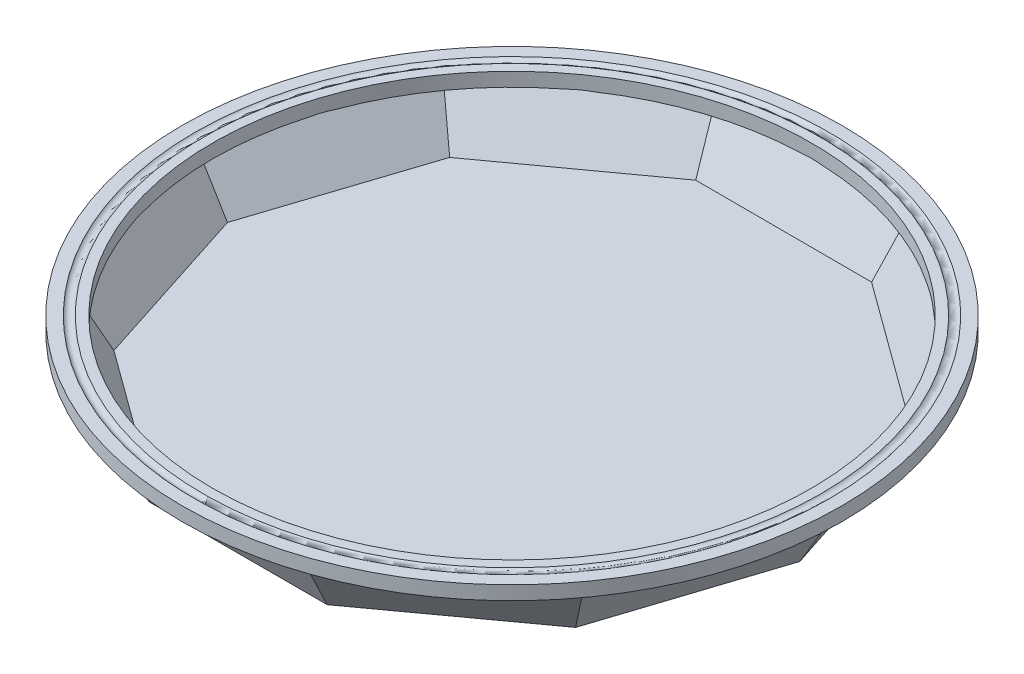
from build123d import *

# Parameters (mm, degrees)
STAGE1EX_DEPTH      = 30
STAGE1EX_DRAFT      = -30
STAGE1IN_DEPTH      = 27
STAGE1IN_DRAFT      = -30
SKETCH8_R           = 143.211859946
SKETCH8_R_2         = 130
BOSS_EXTRUDE2_DEPTH = 6
SKETCH15_R          = 2.38


with BuildPart() as part:
    # Sketch4 → Stage1Ex (with draft: the straight prism first)
    with BuildSketch(Plane(origin=(0, 0, 0), x_dir=(1, 0, 0), z_dir=(0, 1, 0))):
        Polygon((38.627124297, -118.882064537), (101.127124297, -73.473156537), (125, 0), (101.127124297, 73.473156537), (38.627124297, 118.882064537), (-38.627124297, 118.882064537), (-101.127124297, 73.473156537), (-125, 0), (-101.127124297, -73.473156537), (-38.627124297, -118.882064537), align=None)
    extrude(amount=STAGE1EX_DEPTH)
    # Stage1Ex: the draft: its side faces are tilted about the plane it starts from
    stage1ex_sides = [part.faces().sort_by_distance(p)[0] for p in [
        (69.877124297, 15, 96.177610537),
        (113.063562148, 15, 36.736578268),
        (113.063562148, 15, -36.736578268),
        (69.877124297, 15, -96.177610537),
        (0, 15, -118.882064537),
        (-69.877124297, 15, -96.177610537),
        (-113.063562148, 15, -36.736578268),
        (-113.063562148, 15, 36.736578268),
        (-69.877124297, 15, 96.177610537),
        (0, 15, 118.882064537),
    ]]
    draft(stage1ex_sides, Plane(origin=(0, 0, 0), x_dir=(1, 0, 0), z_dir=(0, 1, 0)), STAGE1EX_DRAFT)


with BuildPart() as stage1in_tool:
    # Sketch7 → Stage1In (with draft: the straight prism first)
    with BuildSketch(Plane(origin=(0, 30, 0), x_dir=(1, 0, 0), z_dir=(0, 1, 0))):
        Polygon((-140.223274297, 0.261449456), (-113.596688048, -82.209655607), (-43.580027974, -133.279466431), (43.082721556, -133.441051082), (113.289335779, -82.632689713), (140.223274297, -0.261449456), (113.596688048, 82.209655607), (43.580027974, 133.279466431), (-43.082721556, 133.441051082), (-113.289335779, 82.632689713), align=None)
    extrude(amount=-STAGE1IN_DEPTH)
    # Stage1In: the draft: its side faces are tilted about the plane it starts from
    stage1in_sides = [stage1in_tool.faces().sort_by_distance(p)[0] for p in [
        (-126.909981172, 16.5, 40.974103075),
        (-78.588358011, 16.5, 107.744561019),
        (-0.248653209, 16.5, 133.360258757),
        (78.186028667, 16.5, 108.036870397),
        (126.756305038, 16.5, 41.447069585),
        (126.909981172, 16.5, -40.974103075),
        (78.588358011, 16.5, -107.744561019),
        (0.248653209, 16.5, -133.360258757),
        (-78.186028667, 16.5, -108.036870397),
        (-126.756305038, 16.5, -41.447069585),
    ]]
    draft(stage1in_sides, Plane(origin=(0, 30, 0), x_dir=(1, 0, 0), z_dir=(0, 1, 0)), STAGE1IN_DRAFT)


with BuildPart() as part_1:
    add(part.part)

    # Stage1In: cut by stage1in_tool
    add(stage1in_tool.part, mode=Mode.SUBTRACT)

    # Sketch8 → Boss-Extrude2 (add)
    with BuildSketch(Plane(origin=(0, 30, 0), x_dir=(1, 0, 0), z_dir=(0, 1, 0))):
        with Locations(Location((0, 0, 0), (0, 0, 270))):
            Circle(SKETCH8_R)
        with Locations(Location((0, 0, 0), (0, 0, 270))):
            Circle(SKETCH8_R_2, mode=Mode.SUBTRACT)
    extrude(amount=-BOSS_EXTRUDE2_DEPTH)

    # Cut-Sweep1: sweep along a path in Sketch14
    with BuildLine(Plane(origin=(0, 30, 0), x_dir=(1, 0, 0), z_dir=(0, 1, 0))) as cut_sweep1_path:
        CenterArc((0, 0), 136, 0, 360)
    # Sketch15 → Cut-Sweep1 (sweep, cut)
    with BuildSketch(Plane(origin=(0, 0, 0), x_dir=(-0.9999982617823745, 0, -0.0018645193026112638), z_dir=(0.0018645193026112638, 0, -0.9999982617823745))):
        with Locations((-135.972501612, 31.5)):
            Circle(SKETCH15_R)
    sweep(path=cut_sweep1_path.line, mode=Mode.SUBTRACT)


solid = part_1.part
